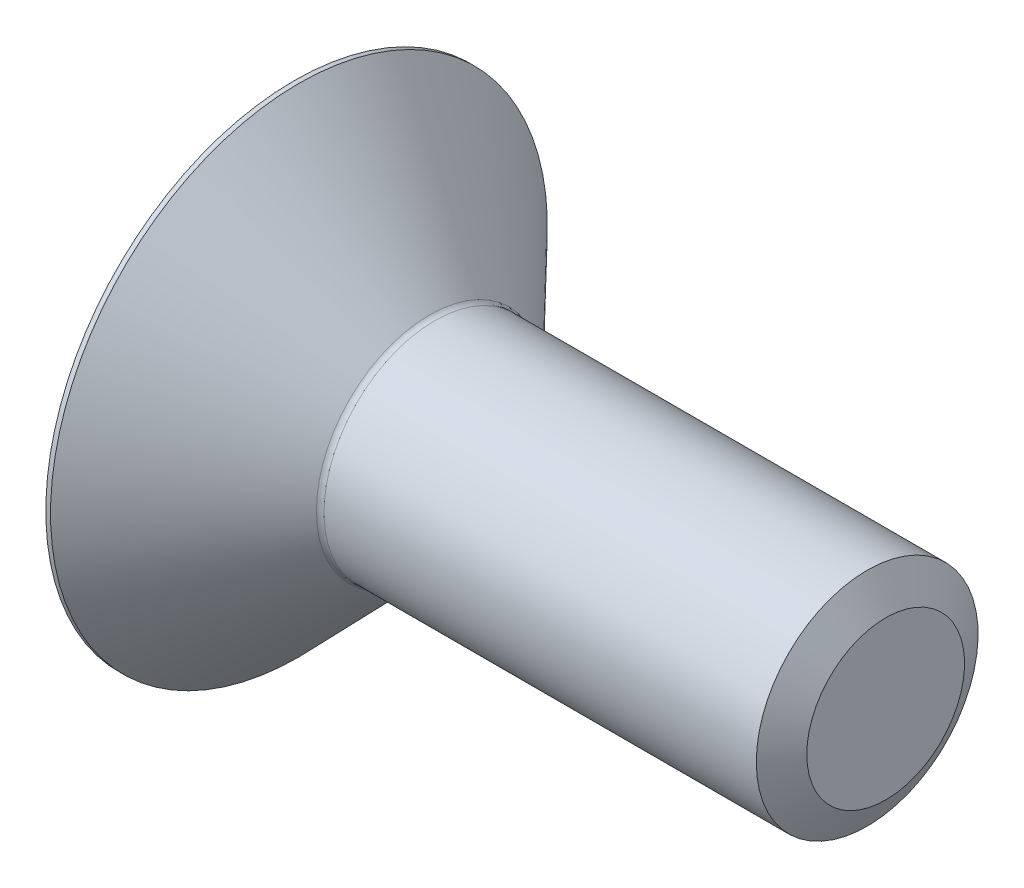
from build123d import *

# Parameters (mm, degrees)
CUT_EXTRUDE_1_DEPTH = 1.96


with BuildPart() as part:
    # 草图1 → 旋转1 (revolve)
    with BuildSketch(Plane.XY):
        with BuildLine():
            Line((0, 1.5), (-6.097552518, 1.5))
            ThreePointArc((-6.097552518, 1.5), (-6.136625631, 1.507949515), (-6.169486498, 1.530534163))
            Line((-6.169486498, 1.530534163), (-7.936181121, 3.36))
            Line((-7.936181121, 3.36), (-8, 3.36))
            Line((-8, 3.36), (-8, 0))
            Line((-8, 0), (0, 0))
            Line((0, 0), (0, 1.5))
        make_face()
    revolve(axis=Axis((0, 0, 0), (-1, 0, 0)))

    # 草图2 → 切除-拉伸1 (cut)
    with BuildSketch(Plane.ZY.offset(8)):
        Polygon((0, 1.154700538), (-1, 0.577350269), (-1, -0.577350269), (0, -1.154700538), (1, -0.577350269), (1, 0.577350269), align=None)
    extrude(amount=-CUT_EXTRUDE_1_DEPTH, mode=Mode.SUBTRACT)

    # 草图6 → 旋转2 (revolve)
    with BuildSketch(Plane.XY):
        Polygon((-6.9, 1.154700538), (-6.233333333, 0), (-5.74, 0), (-5.74, 1.154700538), align=None)
    revolve(axis=Axis((-8, 0, 0), (1, 0, 0)))

    # 草图7 → 切除-旋转2 (revolve, cut)
    with BuildSketch(Plane.XY):
        Polygon((-8, 1.154700538), (-8, 0), (-7.67, 0), align=None)
    revolve(axis=Axis((-8, 0, 0), (1, 0, 0)), mode=Mode.SUBTRACT)

    # 草图4 → 切除-旋转1 (revolve, cut)
    with BuildSketch(Plane.XY):
        Polygon((-0.25, 1.5), (0, 1.066987298), (0.25, 1.5), align=None)
    revolve(axis=Axis((-0.25, 0, 0), (1, 0, 0)), mode=Mode.SUBTRACT)


solid = part.part
